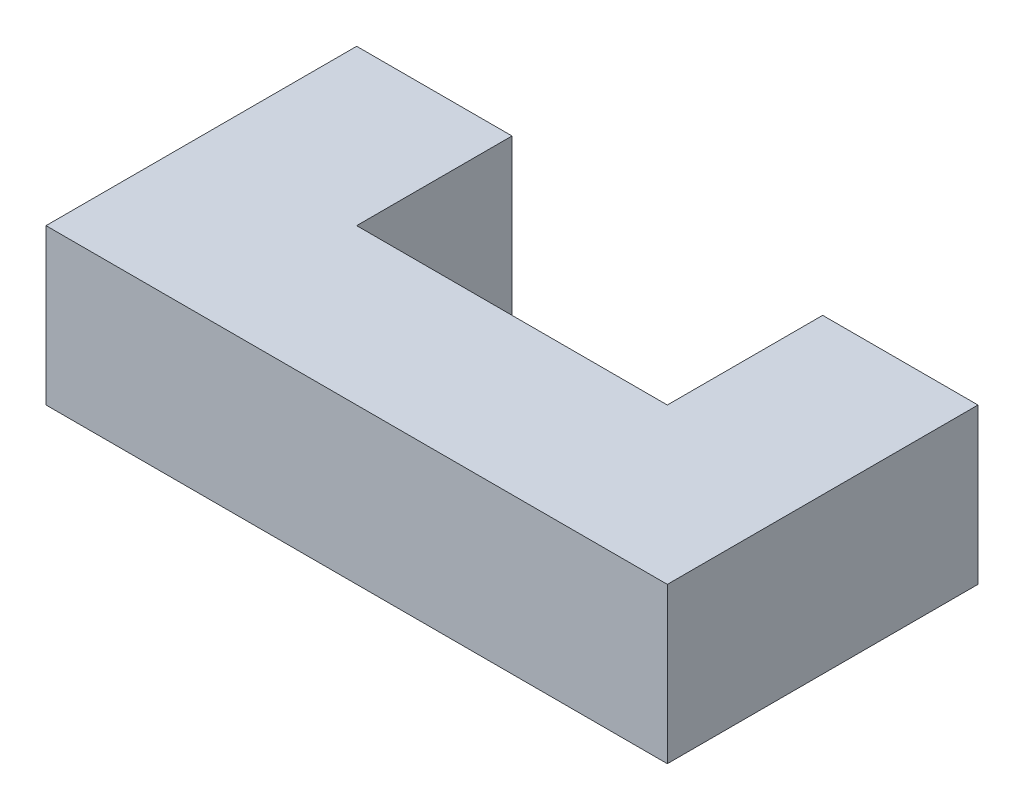
from build123d import *

# Parameters (mm, degrees)
BOSS_EXTRUDE1_DEPTH = 5


with BuildPart() as part:
    # Sketch1 → Boss-Extrude1 (new body)
    with BuildSketch(Plane(origin=(0, 0, 0), x_dir=(1, 0, 0), z_dir=(0, 1, 0))):
        Polygon((-10, 5), (-10, -5), (10, -5), (10, 5), (5, 5), (5, 0), (-5, 0), (-5, 5), align=None)
    extrude(amount=BOSS_EXTRUDE1_DEPTH)


solid = part.part
